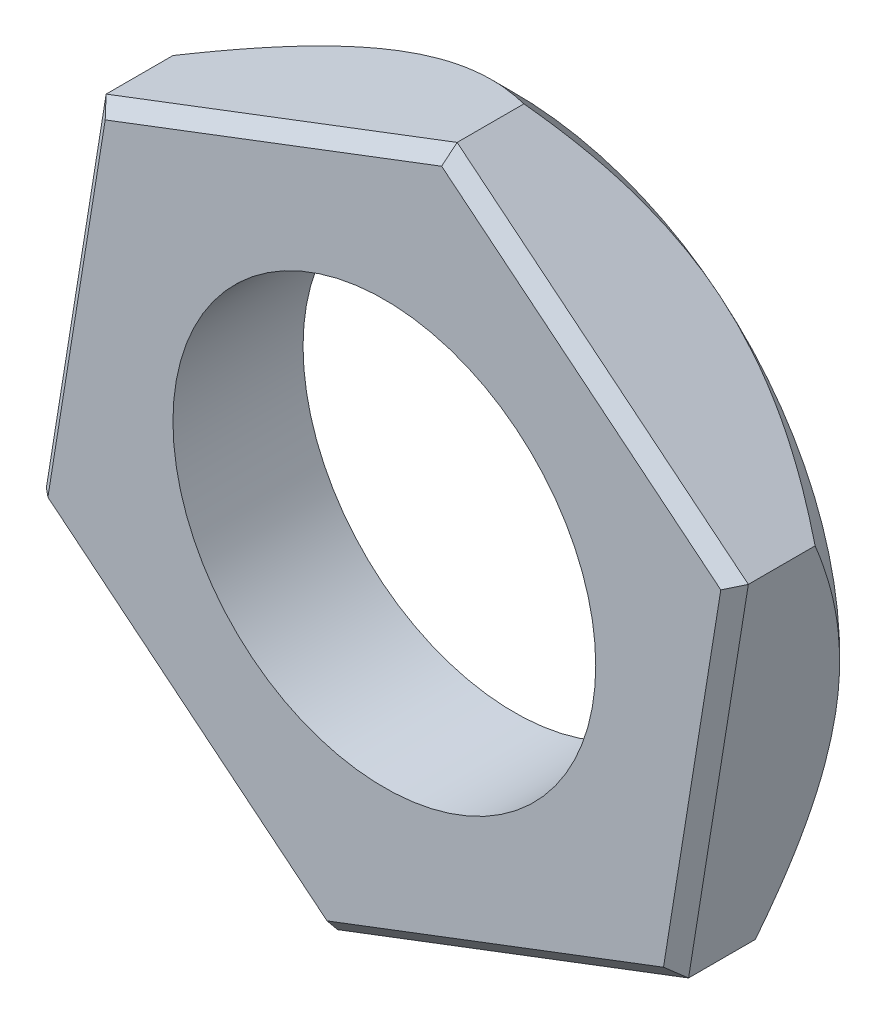
from build123d import *
from OCP.BRepFilletAPI import BRepFilletAPI_MakeChamfer

# Parameters (mm, degrees)
CROQUIS1_R              = 3.25
SALIENTE_EXTRUIR1_DEPTH = 2
CROQUIS2_OUTSIDE_W      = 17.956
CROQUIS2_OUTSIDE_H      = 18.564
CROQUIS2_OUTSIDE_R      = 5
CORTAR_EXTRUIR1_DEPTH   = 1
CORTAR_EXTRUIR1_DRAFT   = -45
CHAFL_N2_SIZE           = 0.2
CHAFL_N2_SIZE2          = 0.207106063


with BuildPart() as part:
    # Croquis1 → Saliente-Extruir1 (new body)
    with BuildSketch(Plane.XY):
        Polygon((-5.395674006, -2.054272462), (-0.918784865, -5.699926991), (4.476889142, -3.645654529), (5.395674006, 2.054272462), (0.918784865, 5.699926991), (-4.476889142, 3.645654529), align=None)
        Circle(CROQUIS1_R, mode=Mode.SUBTRACT)
    extrude(amount=SALIENTE_EXTRUIR1_DEPTH)


with BuildPart() as cortar_extruir1_tool:
    # Croquis2 outside → Cortar-Extruir1 (with draft: the straight prism first)
    with BuildSketch(Plane(origin=(0, 0, 0), x_dir=(-1, 0, 0), z_dir=(0, 0, -1))):
        Rectangle(CROQUIS2_OUTSIDE_W, CROQUIS2_OUTSIDE_H)
        Circle(CROQUIS2_OUTSIDE_R, mode=Mode.SUBTRACT)
    extrude(amount=-CORTAR_EXTRUIR1_DEPTH)
    # Cortar-Extruir1: the draft: its side faces are tilted about the plane it starts from
    cortar_extruir1_sides = [cortar_extruir1_tool.faces().sort_by_distance(p)[0] for p in [
        (0, -9.282, 0.5),
        (-8.978, 0, 0.5),
        (0, 9.282, 0.5),
        (8.978, 0, 0.5),
        (5, 0, 0.5),
    ]]
    draft(cortar_extruir1_sides, Plane(origin=(0, 0, 0), x_dir=(-1, 0, 0), z_dir=(0, 0, -1)), CORTAR_EXTRUIR1_DRAFT)


with BuildPart() as part_1:
    add(part.part)

    # Cortar-Extruir1: cut by cortar_extruir1_tool
    add(cortar_extruir1_tool.part, mode=Mode.SUBTRACT)

    # Chaflán2: one chamfer whose edges measure the first distance from different faces: ONE call of the kernel's chamfer builder (chamfer() names one face for all edges)
    chafl_n2_edges_1 = [part_1.edges().sort_by_distance(p)[0] for p in [
        (1.779052139, -4.67279076, 2),
    ]]
    chafl_n2_side_1 = [part_1.faces().sort_by_distance(p)[0] for p in [
        (1.779052139, -4.67279076, 1.117030845),
    ]]
    chafl_n2_edges_2 = [part_1.edges().sort_by_distance(p)[0] for p in [
        (4.936281574, -0.795691033, 2),
    ]]
    chafl_n2_side_2 = [part_1.faces().sort_by_distance(p)[0] for p in [
        (4.936281574, -0.795691033, 1.117030845),
    ]]
    chafl_n2_edges_3 = [part_1.edges().sort_by_distance(p)[0] for p in [
        (3.157229436, 3.877099727, 2),
    ]]
    chafl_n2_side_3 = [part_1.faces().sort_by_distance(p)[0] for p in [
        (3.157229436, 3.877099727, 1.117030845),
    ]]
    chafl_n2_edges_4 = [part_1.edges().sort_by_distance(p)[0] for p in [
        (-1.779052139, 4.67279076, 2),
    ]]
    chafl_n2_side_4 = [part_1.faces().sort_by_distance(p)[0] for p in [
        (-1.779052139, 4.67279076, 1.117030845),
    ]]
    chafl_n2_edges_5 = [part_1.edges().sort_by_distance(p)[0] for p in [
        (-4.936281574, 0.795691033, 2),
    ]]
    chafl_n2_side_5 = [part_1.faces().sort_by_distance(p)[0] for p in [
        (-4.936281574, 0.795691033, 1.117030845),
    ]]
    chafl_n2_edges_6 = [part_1.edges().sort_by_distance(p)[0] for p in [
        (-3.157229436, -3.877099727, 2),
    ]]
    chafl_n2_side_6 = [part_1.faces().sort_by_distance(p)[0] for p in [
        (-3.157229436, -3.877099727, 1.117030845),
    ]]
    chafl_n2 = BRepFilletAPI_MakeChamfer(part_1.part.solid().wrapped)
    for e in chafl_n2_edges_1:
        chafl_n2.Add(CHAFL_N2_SIZE, CHAFL_N2_SIZE2, e.wrapped, chafl_n2_side_1[0].wrapped)  # the first distance lies on this face
    for e in chafl_n2_edges_2:
        chafl_n2.Add(CHAFL_N2_SIZE, CHAFL_N2_SIZE2, e.wrapped, chafl_n2_side_2[0].wrapped)  # the first distance lies on this face
    for e in chafl_n2_edges_3:
        chafl_n2.Add(CHAFL_N2_SIZE, CHAFL_N2_SIZE2, e.wrapped, chafl_n2_side_3[0].wrapped)  # the first distance lies on this face
    for e in chafl_n2_edges_4:
        chafl_n2.Add(CHAFL_N2_SIZE, CHAFL_N2_SIZE2, e.wrapped, chafl_n2_side_4[0].wrapped)  # the first distance lies on this face
    for e in chafl_n2_edges_5:
        chafl_n2.Add(CHAFL_N2_SIZE, CHAFL_N2_SIZE2, e.wrapped, chafl_n2_side_5[0].wrapped)  # the first distance lies on this face
    for e in chafl_n2_edges_6:
        chafl_n2.Add(CHAFL_N2_SIZE, CHAFL_N2_SIZE2, e.wrapped, chafl_n2_side_6[0].wrapped)  # the first distance lies on this face
    add(Compound.cast(chafl_n2.Shape()), mode=Mode.REPLACE)


solid = part_1.part
